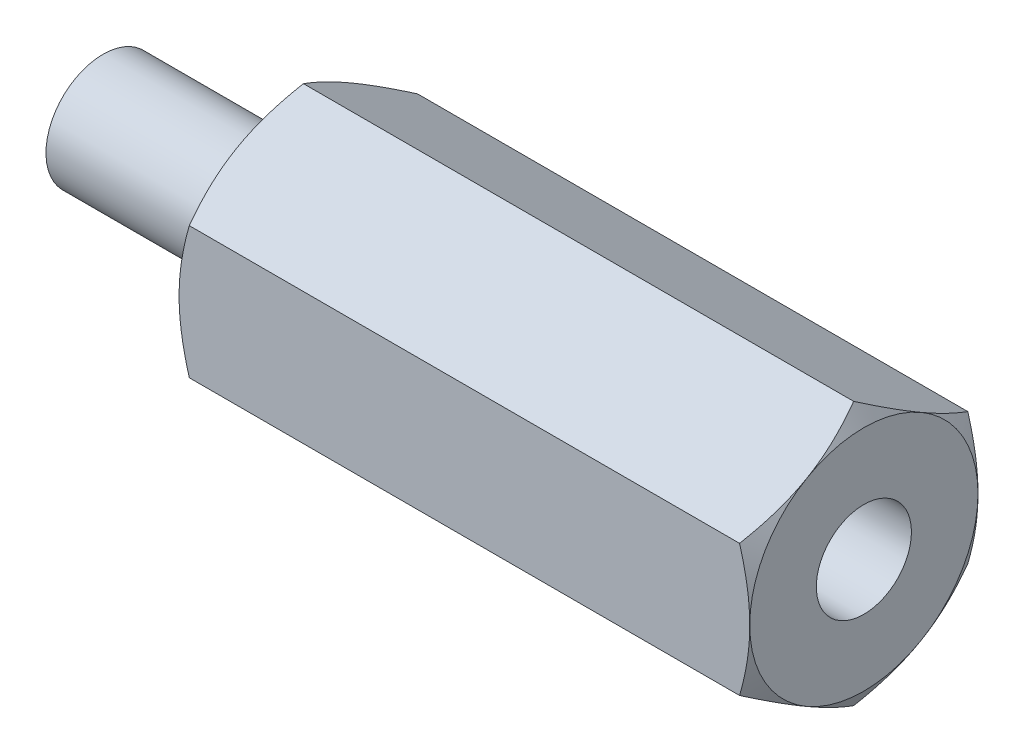
from build123d import *

# Parameters (mm, degrees)
BOSS_EXTRUDE1_DEPTH = 15
SKETCH3_W           = 5
SKETCH3_H           = 1.5
TAPPED_HOLE1_D      = 2.5
TAPPED_HOLE1_DEPTH  = 8.5
TAPPED_HOLE1_TIP    = 0.751075774
FILLET1_R           = 0.5


with BuildPart() as part:
    # Sketch1 → Boss-Extrude1 (new body)
    with BuildSketch(Plane(origin=(0, 0, 0), x_dir=(0, 0, -1), z_dir=(1, 0, 0))):
        Polygon((0, 3.464101615), (-3, 1.732050808), (-3, -1.732050808), (0, -3.464101615), (3, -1.732050808), (3, 1.732050808), align=None)
    extrude(amount=BOSS_EXTRUDE1_DEPTH)

    # Sketch2 → Cut-Revolve1 (revolve, cut)
    with BuildSketch(Plane.XY):
        Polygon((0.267949192, 3.464101615), (0, 3.464101615), (0, 3), align=None)
        Polygon((15, 3), (15, 3.464101615), (14.732050808, 3.464101615), align=None)
    revolve(axis=Axis((0, 0, 0), (1, 0, 0)), mode=Mode.SUBTRACT)

    # Sketch3 → Revolve1 (revolve)
    with BuildSketch(Plane.XY):
        with Locations((-2.5, 0.75)):
            Rectangle(SKETCH3_W, SKETCH3_H)
    revolve(axis=Axis((0, 0, 0), (-1, 0, 0)))

    # Tapped Hole1
    with Locations(Plane(origin=(15, 0, 0), x_dir=(0, 0, -1), z_dir=(1, 0, 0))):
        with Locations((0, 0)):
            Hole(TAPPED_HOLE1_D / 2, depth=TAPPED_HOLE1_DEPTH)
            with Locations((0, 0, -(TAPPED_HOLE1_DEPTH + TAPPED_HOLE1_TIP / 2))):  # 118° drill point
                Cone(0, TAPPED_HOLE1_D / 2, TAPPED_HOLE1_TIP, mode=Mode.SUBTRACT)

    # Fillet1
    fillet1_edges = [part.edges().sort_by_distance(p)[0] for p in [
        (0, -1.5, 0),
    ]]
    fillet(fillet1_edges, radius=FILLET1_R)


solid = part.part
